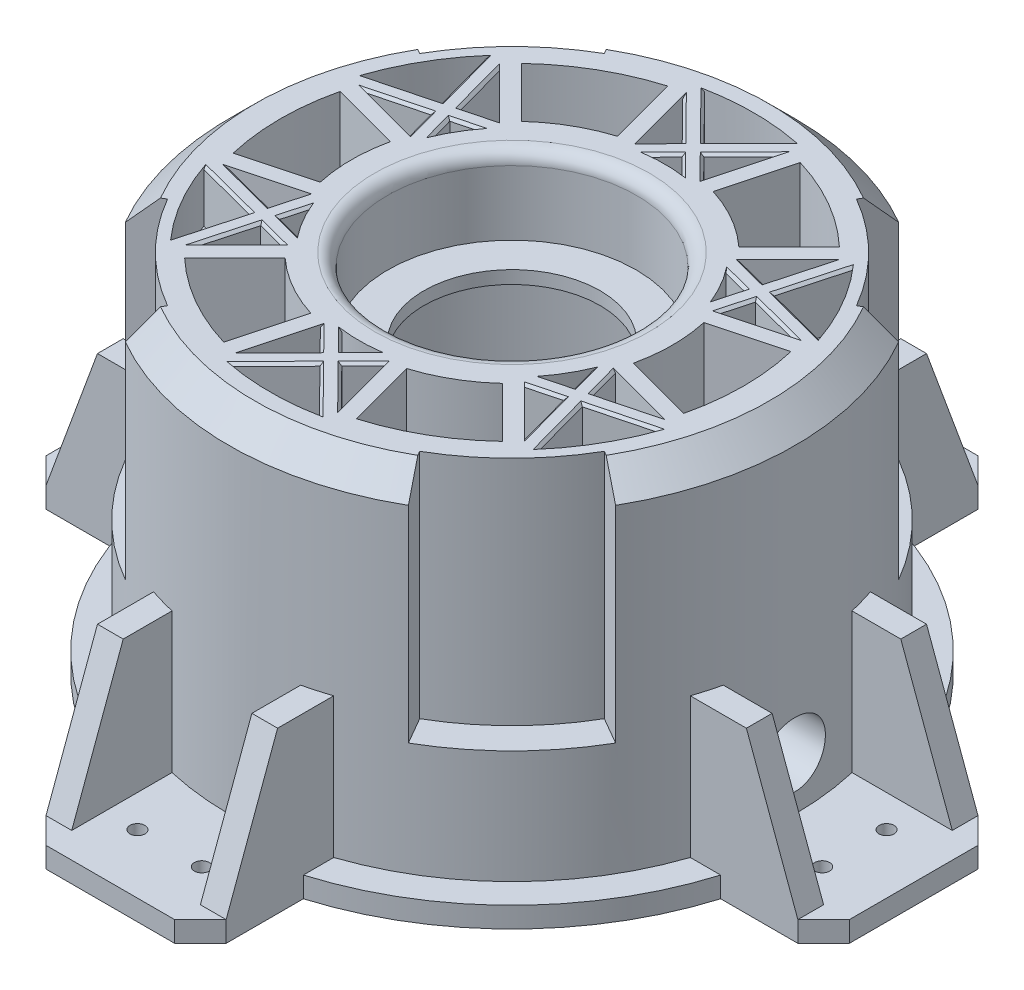
from build123d import *

# Parameters (mm, degrees)
SKETCH1_R                    = 60.625
SKETCH1_R_2                  = 45
BOSS_EXTRUDE1_DEPTH          = 4
SKETCH2_R                    = 55
SKETCH2_R_2                  = 45
BOSS_EXTRUDE2_DEPTH          = 67
SKETCH3_W                    = 8
SKETCH3_H                    = 30.5
SKETCH3_W_2                  = 15
SKETCH3_H_2                  = 8
BOSS_EXTRUDE3_DEPTH          = 13
SKETCH4_W                    = 10
SKETCH4_H                    = 16
CUT_EXTRUDE1_DEPTH           = 8
SKETCH5_R                    = 6.25
CUT_EXTRUDE2_DEPTH           = 118.82362348
SKETCH6_R                    = 1.3
CUT_EXTRUDE3_DEPTH           = 7.2
BOSS_EXTRUDE4_DEPTH          = 4
BOSS_EXTRUDE5_DEPTH          = 4
CHAMFER1_SIZE                = 5
BOSS_EXTRUDE6_DEPTH          = 5
SKETCH11_R                   = 1.45
CUT_EXTRUDE5_DEPTH           = 5
CIRPATTERN1_COUNT            = 4
CIRPATTERN1_COPY_1_DEPTH     = 5
CIRPATTERN1_COPY_2_DEPTH     = 5
CIRPATTERN1_COPY_3_DEPTH     = 5
CIRPATTERN1_COPY_4_SKETCH_R  = 1.45
CIRPATTERN1_COPY_4_DEPTH     = 5
CIRPATTERN1_COPY_5_SKETCH_R  = 1.45
CIRPATTERN1_COPY_5_DEPTH     = 5
CIRPATTERN1_COPY_6_SKETCH_R  = 1.45
CIRPATTERN1_COPY_6_DEPTH     = 5
CHAMFER1_OF_CIRPATTERN1_SIZE = 5
CUT_EXTRUDE6_DEPTH           = 45
CIRPATTERN2_COUNT            = 4
SKETCH13_R                   = 24.2
BOSS_EXTRUDE7_DEPTH          = 17.5
SKETCH14_R                   = 24.125
SKETCH14_R_2                 = 17.125
BOSS_EXTRUDE8_DEPTH          = 2.5
FILLET1_R                    = 2.5
CHAMFER2_SIZE                = 5
CUT_EXTRUDE7_DEPTH           = 10
CHAMFER3_SIZE                = 0.5
CIRPATTERN4_COUNT            = 6
CHAMFER3_OF_CIRPATTERN4_SIZE = 0.5
FILLET2_R                    = 2.5


with BuildPart() as part:
    # Sketch1 → Boss-Extrude1 (new body)
    with BuildSketch(Plane(origin=(0, 0, 0), x_dir=(1, 0, 0), z_dir=(0, 1, 0))):
        with Locations(Location((0, 0, 0), (0, 0, 270))):
            Circle(SKETCH1_R)
        with Locations(Location((0, 0, 0), (0, 0, 270))):
            Circle(SKETCH1_R_2, mode=Mode.SUBTRACT)
    extrude(amount=BOSS_EXTRUDE1_DEPTH)

    # Sketch2 → Boss-Extrude2 (add)
    with BuildSketch(Plane(origin=(0, 4, 0), x_dir=(1, 0, 0), z_dir=(0, 1, 0))):
        with Locations(Location((0, 0, 0), (0, 0, 270))):
            Circle(SKETCH2_R)
        with Locations(Location((0, 0, 0), (0, 0, 270))):
            Circle(SKETCH2_R_2, mode=Mode.SUBTRACT)
    extrude(amount=BOSS_EXTRUDE2_DEPTH)

    # Sketch3 → Boss-Extrude3 (add, symmetric)
    with BuildSketch(Plane.XY):
        with Locations((15.25, 15.25)):
            Rectangle(SKETCH3_W, SKETCH3_H)
        with Locations((-39.25, 26.5)):
            Rectangle(SKETCH3_W_2, SKETCH3_H_2)
    extrude(amount=BOSS_EXTRUDE3_DEPTH, both=True)


with BuildPart() as boss_extrude3_piece_1:
    # of the separate pieces the step leaves, piece 1, a body of its own (boss_extrude3_pieces)
    add(part.part.solids().sort_by_distance((0, 0, 60.625))[0])

    # Sketch5 → Cut-Extrude2 (cut, through all)
    with BuildSketch(Plane.ZY.offset(-11.25)):
        with Locations((0, 14)):
            Circle(SKETCH5_R)
    extrude(amount=-CUT_EXTRUDE2_DEPTH, mode=Mode.SUBTRACT)


with BuildPart() as boss_extrude3_piece_2:
    # of the separate pieces the step leaves, piece 2, a body of its own (boss_extrude3_pieces)
    add(part.part.solids().sort_by_distance((11.25, 0, -13))[0])

    # Sketch4 → Cut-Extrude1 (cut)
    with BuildSketch(Plane.ZY.offset(-11.25)):
        with Locations((0, 13)):
            Rectangle(SKETCH4_W, SKETCH4_H)
    extrude(amount=-CUT_EXTRUDE1_DEPTH, mode=Mode.SUBTRACT)


with BuildPart() as cut_extrude3_tool:
    # Sketch6 → Cut-Extrude3 (new body)
    with BuildSketch(Plane(origin=(0, 30.5, 0), x_dir=(1, 0, 0), z_dir=(0, 1, 0))):
        with Locations(Location((-34.25, 5, 0), (0, 0, 270))):
            Circle(SKETCH6_R)
        with Locations(Location((-34.25, -5, 0), (0, 0, 270))):
            Circle(SKETCH6_R)
        with Locations(Location((13.75, 5, 0), (0, 0, 270))):
            Circle(SKETCH6_R)
        with Locations(Location((13.75, -5, 0), (0, 0, 270))):
            Circle(SKETCH6_R)
    extrude(amount=-CUT_EXTRUDE3_DEPTH)


with BuildPart() as boss_extrude3_piece_1_1:
    add(boss_extrude3_piece_1.part)

    # Cut-Extrude3: cut by cut_extrude3_tool
    add(cut_extrude3_tool.part, mode=Mode.SUBTRACT)



with BuildPart() as boss_extrude3_piece_2_1:
    add(boss_extrude3_piece_2.part)

    # Cut-Extrude3: cut by cut_extrude3_tool
    add(cut_extrude3_tool.part, mode=Mode.SUBTRACT)


with BuildPart() as boss_extrude3_piece_1_2:
    add(boss_extrude3_piece_1_1.part)

    add(boss_extrude3_piece_2_1.part)  # Boss-Extrude4 merges Boss-Extrude3 piece 2
    # Sketch7 → Boss-Extrude4 (add)
    with BuildSketch(Plane.XZ):
        with BuildLine():
            Line((11.25, 13), (25.249838503, 37.248431585))
            ThreePointArc((25.249838503, 37.248431585), (45, 0), (25.249838503, -37.248431585))
            Line((25.249838503, -37.248431585), (11.25, -13))
            Line((11.25, -13), (11.25, 13))
        make_face()
        with BuildLine():
            Line((24.25, 19.516660498), (27.361802413, 24.906460381))
            ThreePointArc((27.361802413, 24.906460381), (37, 0), (27.361802413, -24.906460381))
            Line((27.361802413, -24.906460381), (24.25, -19.516660498))
            Line((24.25, -19.516660498), (24.25, 19.516660498))
        make_face(mode=Mode.SUBTRACT)
    extrude(amount=-BOSS_EXTRUDE4_DEPTH)

    # Sketch9 → Boss-Extrude5 (add)
    with BuildSketch(Plane.XZ):
        with BuildLine():
            Line((-78.044298816, 17.5), (-78.044298816, -17.5))
            Line((-78.044298816, -17.5), (-58.044298816, -17.5))
            ThreePointArc((-58.044298816, -17.5), (-60.625, 0), (-58.044298816, 17.5))
            Line((-58.044298816, 17.5), (-78.044298816, 17.5))
        make_face()
    boss_extrude5 = extrude(amount=-BOSS_EXTRUDE5_DEPTH)

    # Chamfer1
    chamfer1_edges = [boss_extrude3_piece_1_2.edges().sort_by_distance(p)[0] for p in [
        (-78.044298816, 2, 17.5),
        (-78.044298816, 2, -17.5),
    ]]
    chamfer(chamfer1_edges, length=CHAMFER1_SIZE)

    # Sketch10 → Boss-Extrude6 (add)
    with BuildSketch(Plane.XY.offset(17.5)):
        Polygon((-43.288129696, 0), (-43.288129696, 31.207883111), (-63.044298816, 31.207883111), (-73.044298816, 4), (-73.044298816, 0), align=None)
    boss_extrude6 = extrude(amount=-BOSS_EXTRUDE6_DEPTH)

    # Sketch11 → Cut-Extrude5 (cut)
    with BuildSketch(Plane(origin=(0, 4, 0), x_dir=(1, 0, 0), z_dir=(0, 1, 0))):
        with Locations(Location((-66.522149408, -6.25, 0), (0, 0, 270))):
            Circle(SKETCH11_R)
    cut_extrude5 = extrude(amount=-CUT_EXTRUDE5_DEPTH, mode=Mode.SUBTRACT)

    # Mirror1: Boss-Extrude6, Cut-Extrude5 across plane
    add(boss_extrude6.mirror(Plane.XY))
    add(cut_extrude5.mirror(Plane.XY), mode=Mode.SUBTRACT)

    # CirPattern1: Boss-Extrude5, Boss-Extrude6, Cut-Extrude5 ×4 about axis
    cirpattern1_axis = Axis((0, 0, 0), (0, 1, 0))
    add([boss_extrude5.rotate(cirpattern1_axis, i * 360 / CIRPATTERN1_COUNT) for i in range(1, CIRPATTERN1_COUNT)])
    add([boss_extrude6.rotate(cirpattern1_axis, i * 360 / CIRPATTERN1_COUNT) for i in range(1, CIRPATTERN1_COUNT)])
    add([cut_extrude5.rotate(cirpattern1_axis, i * 360 / CIRPATTERN1_COUNT) for i in range(1, CIRPATTERN1_COUNT)], mode=Mode.SUBTRACT)

    # CirPattern1 copy 1 sketch → CirPattern1 copy 1 (add)
    with BuildSketch(Plane(origin=(-17.5, 0, 0), x_dir=(0, 0, -1), z_dir=(-1, 0, 0))):
        Polygon((-43.288129696, 0), (-43.288129696, -31.207883111), (-63.044298816, -31.207883111), (-73.044298816, -4), (-73.044298816, 0), align=None)
    extrude(amount=-CIRPATTERN1_COPY_1_DEPTH)

    # CirPattern1 copy 2 sketch → CirPattern1 copy 2 (add)
    with BuildSketch(Plane(origin=(0, 0, 17.5), x_dir=(-1, 0, 0), z_dir=(0, 0, 1))):
        Polygon((-43.288129696, 0), (-43.288129696, -31.207883111), (-63.044298816, -31.207883111), (-73.044298816, -4), (-73.044298816, 0), align=None)
    extrude(amount=-CIRPATTERN1_COPY_2_DEPTH)

    # CirPattern1 copy 3 sketch → CirPattern1 copy 3 (add)
    with BuildSketch(Plane(origin=(17.5, 0, 0), x_dir=(0, 0, 1), z_dir=(1, 0, 0))):
        Polygon((-43.288129696, 0), (-43.288129696, -31.207883111), (-63.044298816, -31.207883111), (-73.044298816, -4), (-73.044298816, 0), align=None)
    extrude(amount=-CIRPATTERN1_COPY_3_DEPTH)

    # CirPattern1 copy 4 sketch → CirPattern1 copy 4 (cut)
    with BuildSketch(Plane(origin=(0, 4, 0), x_dir=(0, 0, -1), z_dir=(0, 1, 0))):
        with Locations((-66.522149408, 6.25)):
            Circle(CIRPATTERN1_COPY_4_SKETCH_R)
    extrude(amount=-CIRPATTERN1_COPY_4_DEPTH, mode=Mode.SUBTRACT)

    # CirPattern1 copy 5 sketch → CirPattern1 copy 5 (cut)
    with BuildSketch(Plane(origin=(0, 4, 0), x_dir=(-1, 0, 0), z_dir=(0, 1, 0))):
        with Locations((-66.522149408, 6.25)):
            Circle(CIRPATTERN1_COPY_5_SKETCH_R)
    extrude(amount=-CIRPATTERN1_COPY_5_DEPTH, mode=Mode.SUBTRACT)

    # CirPattern1 copy 6 sketch → CirPattern1 copy 6 (cut)
    with BuildSketch(Plane.ZX.offset(4)):
        with Locations((-66.522149408, 6.25)):
            Circle(CIRPATTERN1_COPY_6_SKETCH_R)
    extrude(amount=-CIRPATTERN1_COPY_6_DEPTH, mode=Mode.SUBTRACT)

    # Chamfer1 of CirPattern1
    chamfer1_of_cirpattern1_edges = [boss_extrude3_piece_1_2.edges().sort_by_distance(p)[0] for p in [
        (17.5, 2, 78.044298816),
        (-17.5, 2, 78.044298816),
        (78.044298816, 2, -17.5),
        (78.044298816, 2, 17.5),
        (-17.5, 2, -78.044298816),
        (17.5, 2, -78.044298816),
    ]]
    chamfer(chamfer1_of_cirpattern1_edges, length=CHAMFER1_OF_CIRPATTERN1_SIZE)

    # Sketch12 → Cut-Extrude6 (cut)
    with BuildSketch(Plane(origin=(0, 71, 0), x_dir=(1, 0, 0), z_dir=(0, 1, 0))):
        with BuildLine():
            Line((-42.435244785, -24.5), (-47.631397208, -27.5))
            ThreePointArc((-47.631397208, -27.5), (-38.890872965, -38.890872965), (-27.5, -47.631397208))
            Line((-27.5, -47.631397208), (-24.5, -42.435244785))
            ThreePointArc((-24.5, -42.435244785), (-34.648232278, -34.648232278), (-42.435244785, -24.5))
        make_face()
    cut_extrude6 = extrude(amount=-CUT_EXTRUDE6_DEPTH, mode=Mode.SUBTRACT)

    # CirPattern2: Cut-Extrude6 ×4 about axis
    cirpattern2_axis = Axis((0, 71, 0), (0, -1, 0))
    for i in range(1, CIRPATTERN2_COUNT):
        add(cut_extrude6.rotate(cirpattern2_axis, i * 360 / CIRPATTERN2_COUNT), mode=Mode.SUBTRACT)

    # Sketch13 → Boss-Extrude7 (add)
    with BuildSketch(Plane(origin=(0, 71, 0), x_dir=(1, 0, 0), z_dir=(0, 1, 0))):
        with BuildLine():
            Line((9.313731387, 29.777414388), (12.887550937, 43.115090524))
            ThreePointArc((12.887550937, 43.115090524), (0, 45), (-12.887550937, 43.115090524))
            Line((-12.887550937, 43.115090524), (-9.313731387, 29.777414388))
            ThreePointArc((-9.313731387, 29.777414388), (-15.6, 27.019992598), (-21.131131625, 22.95463518))
            Line((-21.131131625, 22.95463518), (-30.894988211, 32.718491766))
            ThreePointArc((-30.894988211, 32.718491766), (-38.97114317, 22.5), (-43.782539148, 10.396598758))
            Line((-43.782539148, 10.396598758), (-30.444863013, 6.822779208))
            ThreePointArc((-30.444863013, 6.822779208), (-31.2, 0), (-30.444863013, -6.822779208))
            Line((-30.444863013, -6.822779208), (-43.782539148, -10.396598758))
            ThreePointArc((-43.782539148, -10.396598758), (-38.97114317, -22.5), (-30.894988211, -32.718491766))
            Line((-30.894988211, -32.718491766), (-21.131131625, -22.95463518))
            ThreePointArc((-21.131131625, -22.95463518), (-15.6, -27.019992598), (-9.313731387, -29.777414388))
            Line((-9.313731387, -29.777414388), (-12.887550937, -43.115090524))
            ThreePointArc((-12.887550937, -43.115090524), (0, -45), (12.887550937, -43.115090524))
            Line((12.887550937, -43.115090524), (9.313731387, -29.777414388))
            ThreePointArc((9.313731387, -29.777414388), (15.6, -27.019992598), (21.131131625, -22.95463518))
            Line((21.131131625, -22.95463518), (30.894988211, -32.718491766))
            ThreePointArc((30.894988211, -32.718491766), (38.97114317, -22.5), (43.782539148, -10.396598758))
            Line((43.782539148, -10.396598758), (30.444863013, -6.822779208))
            ThreePointArc((30.444863013, -6.822779208), (31.2, 0), (30.444863013, 6.822779208))
            Line((30.444863013, 6.822779208), (43.782539148, 10.396598758))
            ThreePointArc((43.782539148, 10.396598758), (38.97114317, 22.5), (30.894988211, 32.718491766))
            Line((30.894988211, 32.718491766), (21.131131625, 22.95463518))
            ThreePointArc((21.131131625, 22.95463518), (15.6, 27.019992598), (9.313731387, 29.777414388))
        make_face()
        with Locations(Location((0, 0, 0), (0, 0, 270))):
            Circle(SKETCH13_R, mode=Mode.SUBTRACT)
    extrude(amount=-BOSS_EXTRUDE7_DEPTH)

    # Fillet1
    fillet1_edges = [boss_extrude3_piece_1_2.edges().sort_by_distance(p)[0] for p in [
        (0, 71, -24.2),
    ]]
    fillet(fillet1_edges, radius=FILLET1_R)

    # Chamfer2
    chamfer2_edges = [boss_extrude3_piece_1_2.edges().sort_by_distance(p)[0] for p in [
        (-14.235047481, 71, 53.125920446),
        (55, 71, 0),
        (0, 71, -55),
        (-55, 71, 0),
    ]]
    chamfer(chamfer2_edges, length=CHAMFER2_SIZE)

    # Sketch16 → Cut-Extrude7 (cut)
    with BuildSketch(Plane(origin=(0, 71, 0), x_dir=(1, 0, 0), z_dir=(0, 1, 0))):
        Polygon((6.471738182, 30.762061268), (9.71940395, 42.882514919), (2.108547281, 35.178600686), align=None)
        with BuildLine():
            Line((0, 37.312929069), (8.756996204, 46.176996627))
            ThreePointArc((8.756996204, 46.176996627), (0, 47), (-8.756996204, 46.176996627))
            Line((-8.756996204, 46.176996627), (0, 37.312929069))
        make_face()
        with BuildLine():
            Line((3.509433645, 29.491928989), (0, 33.044272303))
            Line((0, 33.044272303), (-3.509433645, 29.491928989))
            ThreePointArc((-3.509433645, 29.491928989), (0, 29.7), (3.509433645, 29.491928989))
        make_face()
        Polygon((-6.471738182, 30.762061268), (-2.108547281, 35.178600686), (-9.71940395, 42.882514919), align=None)
    cut_extrude7 = extrude(amount=-CUT_EXTRUDE7_DEPTH, mode=Mode.SUBTRACT)

    # Chamfer3
    chamfer3_edges = [boss_extrude3_piece_1_2.edges().sort_by_distance(p)[0] for p in [
        (5.913975616, 71, -39.030557802),
        (4.290142732, 71, -32.970330977),
        (-1.754716822, 71, -31.268100646),
        (1.754716822, 71, -31.268100646),
        (-5.913975616, 71, -39.030557802),
        (-4.290142732, 71, -32.970330977),
        (4.378498102, 71, -41.744962848),
        (-4.378498102, 71, -41.744962848),
    ]]
    chamfer(chamfer3_edges, length=CHAMFER3_SIZE)

    # CirPattern4: Cut-Extrude7 ×6 about axis
    cirpattern4_axis = Axis((0, 0, 0), (0, 1, 0))
    for i in range(1, CIRPATTERN4_COUNT):
        add(cut_extrude7.rotate(cirpattern4_axis, i * 360 / CIRPATTERN4_COUNT), mode=Mode.SUBTRACT)

    # Chamfer3 of CirPattern4
    chamfer3_of_cirpattern4_edges = [boss_extrude3_piece_1_2.edges().sort_by_distance(p)[0] for p in [
        (-30.844466773, 71, -24.636932022),
        (-26.408072831, 71, -20.20053808),
        (-27.956327899, 71, -14.114420978),
        (-26.201611076, 71, -17.153679668),
        (-36.758442389, 71, -14.393625781),
        (-30.698215563, 71, -12.769792897),
        (-33.962949255, 71, -24.664372011),
        (-38.341447357, 71, -17.080590837),
        (-36.758442389, 71, 14.393625781),
        (-30.698215563, 71, 12.769792897),
        (-26.201611076, 71, 17.153679668),
        (-27.956327899, 71, 14.114420978),
        (-30.844466773, 71, 24.636932022),
        (-26.408072831, 71, 20.20053808),
        (-38.341447357, 71, 17.080590837),
        (-33.962949255, 71, 24.664372011),
        (-5.913975616, 71, 39.030557802),
        (-4.290142732, 71, 32.970330977),
        (1.754716822, 71, 31.268100646),
        (-1.754716822, 71, 31.268100646),
        (5.913975616, 71, 39.030557802),
        (4.290142732, 71, 32.970330977),
        (-4.378498102, 71, 41.744962848),
        (4.378498102, 71, 41.744962848),
        (30.844466773, 71, 24.636932022),
        (26.408072831, 71, 20.20053808),
        (27.956327899, 71, 14.114420978),
        (26.201611076, 71, 17.153679668),
        (36.758442389, 71, 14.393625781),
        (30.698215563, 71, 12.769792897),
        (33.962949255, 71, 24.664372011),
        (38.341447357, 71, 17.080590837),
        (36.758442389, 71, -14.393625781),
        (30.698215563, 71, -12.769792897),
        (26.201611076, 71, -17.153679668),
        (27.956327899, 71, -14.114420978),
        (30.844466773, 71, -24.636932022),
        (26.408072831, 71, -20.20053808),
        (38.341447357, 71, -17.080590837),
        (33.962949255, 71, -24.664372011),
    ]]
    chamfer(chamfer3_of_cirpattern4_edges, length=CHAMFER3_OF_CIRPATTERN4_SIZE)

    # Fillet2
    fillet2_edges = [boss_extrude3_piece_1_2.edges().sort_by_distance(p)[0] for p in [
        (38.97114317, 53.5, -22.5),
        (38.97114317, 53.5, 22.5),
        (-6.512331627, 53.5, 44.526279171),
        (-38.97114317, 53.5, 22.5),
        (-38.97114317, 53.5, -22.5),
        (0, 53.5, -45),
        (-45, 22.5, 0),
    ]]
    fillet(fillet2_edges, radius=FILLET2_R)


with BuildPart() as body_2:
    # Sketch14 → Boss-Extrude8 (new body)
    with BuildSketch(Plane.XZ.offset(-53.5)):
        with Locations(Location((0, 0, 0), (0, 0, 270))):
            Circle(SKETCH14_R)
        with Locations(Location((0, 0, 0), (0, 0, 270))):
            Circle(SKETCH14_R_2, mode=Mode.SUBTRACT)
    extrude(amount=-BOSS_EXTRUDE8_DEPTH)


solid = Compound([boss_extrude3_piece_1_2.part, body_2.part])
